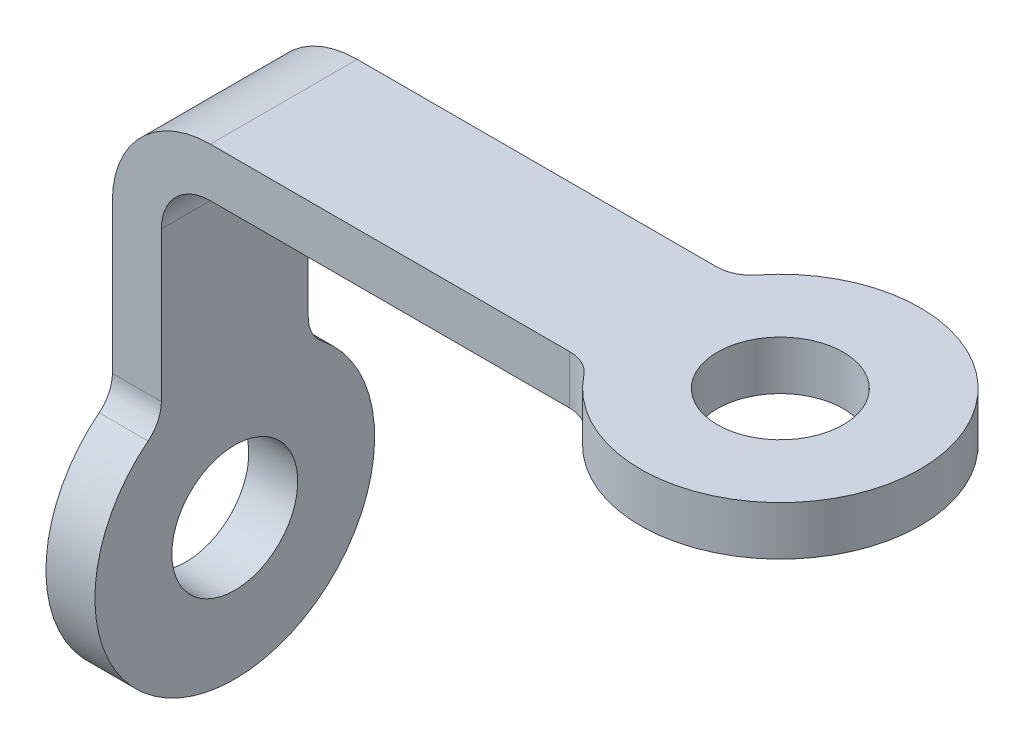
from build123d import *

# Parameters (mm, degrees)
SKETCH1_R           = 9
BOSS_EXTRUDE1_DEPTH = 7
BOSS_EXTRUDE2_START = 85
SKETCH2_R           = 9
BOSS_EXTRUDE2_DEPTH = 7
FILLET1_R           = 14
FILLET2_R           = 7


with BuildPart() as part:
    # Sketch1 → Boss-Extrude1 (new body)
    with BuildSketch(Plane(origin=(0, 0, 0), x_dir=(1, 0, 0), z_dir=(0, 1, 0))):
        with BuildLine():
            Line((-19.615045246, 10.5), (-85, 10.5))
            Line((-85, 10.5), (-85, -10.5))
            Line((-85, -10.5), (-19.615045246, -10.5))
            ThreePointArc((-19.615045246, -10.5), (-17.435595774, -11), (-15.692036197, -12.4))
            ThreePointArc((-15.692036197, -12.4), (20, 0), (-15.692036197, 12.4))
            ThreePointArc((-15.692036197, 12.4), (-17.435595774, 11), (-19.615045246, 10.5))
        make_face()
        with Locations(Location((0, 0, 0), (0, 0, 270))):
            Circle(SKETCH1_R, mode=Mode.SUBTRACT)
    extrude(amount=-BOSS_EXTRUDE1_DEPTH)

    # Sketch2 → Boss-Extrude2 (add)
    with BuildSketch(Plane(origin=(0, -33.238764045, -33.238764045), x_dir=(0, -1, 0), z_dir=(-1, 0, 0)).offset(BOSS_EXTRUDE2_START)):
        with BuildLine():
            Line((2.146190709, 43.738764045), (-33.238764045, 43.738764045))
            Line((-33.238764045, 43.738764045), (-33.238764045, 22.738764045))
            Line((-33.238764045, 22.738764045), (2.146190709, 22.738764045))
            ThreePointArc((2.146190709, 22.738764045), (4.325640181, 22.238764045), (6.069199758, 20.838764045))
            ThreePointArc((6.069199758, 20.838764045), (41.761235955, 33.238764045), (6.069199758, 45.638764045))
            ThreePointArc((6.069199758, 45.638764045), (4.325640181, 44.238764045), (2.146190709, 43.738764045))
        make_face()
        with Locations(Location((21.761235955, 33.238764045, 0), (0, 0, 90))):
            Circle(SKETCH2_R, mode=Mode.SUBTRACT)
    extrude(amount=-BOSS_EXTRUDE2_DEPTH)

    # Fillet1
    fillet1_edges = [part.edges().sort_by_distance(p)[0] for p in [
        (-85, 0, 0),
    ]]
    fillet(fillet1_edges, radius=FILLET1_R)

    # Fillet2
    fillet2_edges = [part.edges().sort_by_distance(p)[0] for p in [
        (-78, -7, 0),
    ]]
    fillet(fillet2_edges, radius=FILLET2_R)


solid = part.part
